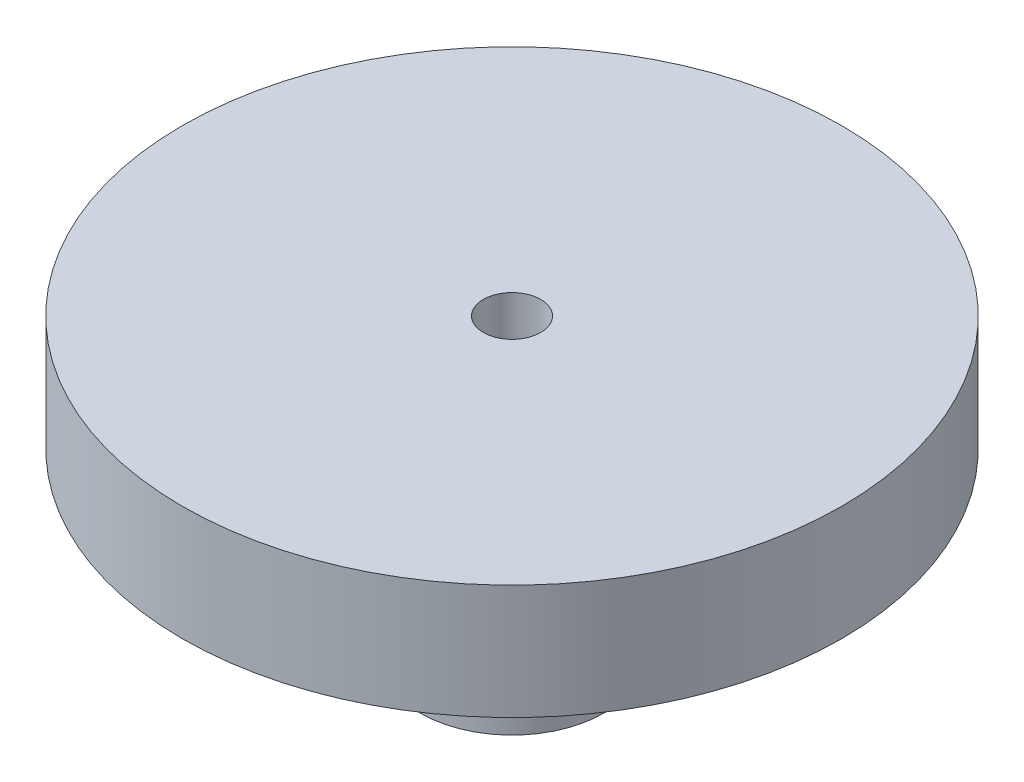
from build123d import *

# Parameters (mm, degrees)
SKETCH1_R           = 8
SKETCH1_R_2         = 2.5
BOSS_EXTRUDE1_DEPTH = 16
SKETCH2_R           = 28.75
SKETCH2_R_2         = 2.5
BOSS_EXTRUDE2_DEPTH = 10


with BuildPart() as part:
    # Sketch1 → Boss-Extrude1 (new body)
    with BuildSketch(Plane(origin=(0, 0, 0), x_dir=(1, 0, 0), z_dir=(0, 1, 0))):
        with Locations(Location((0, 0, 0), (0, 0, 270))):
            Circle(SKETCH1_R)
        with Locations(Location((0, 0, 0), (0, 0, 270))):
            Circle(SKETCH1_R_2, mode=Mode.SUBTRACT)
    extrude(amount=BOSS_EXTRUDE1_DEPTH)

    # Sketch2 → Boss-Extrude2 (add)
    with BuildSketch(Plane(origin=(0, 16, 0), x_dir=(1, 0, 0), z_dir=(0, 1, 0))):
        with Locations(Location((0, 0, 0), (0, 0, 270))):
            Circle(SKETCH2_R)
        with Locations(Location((0, 0, 0), (0, 0, 270))):
            Circle(SKETCH2_R_2, mode=Mode.SUBTRACT)
    extrude(amount=BOSS_EXTRUDE2_DEPTH)


solid = part.part
